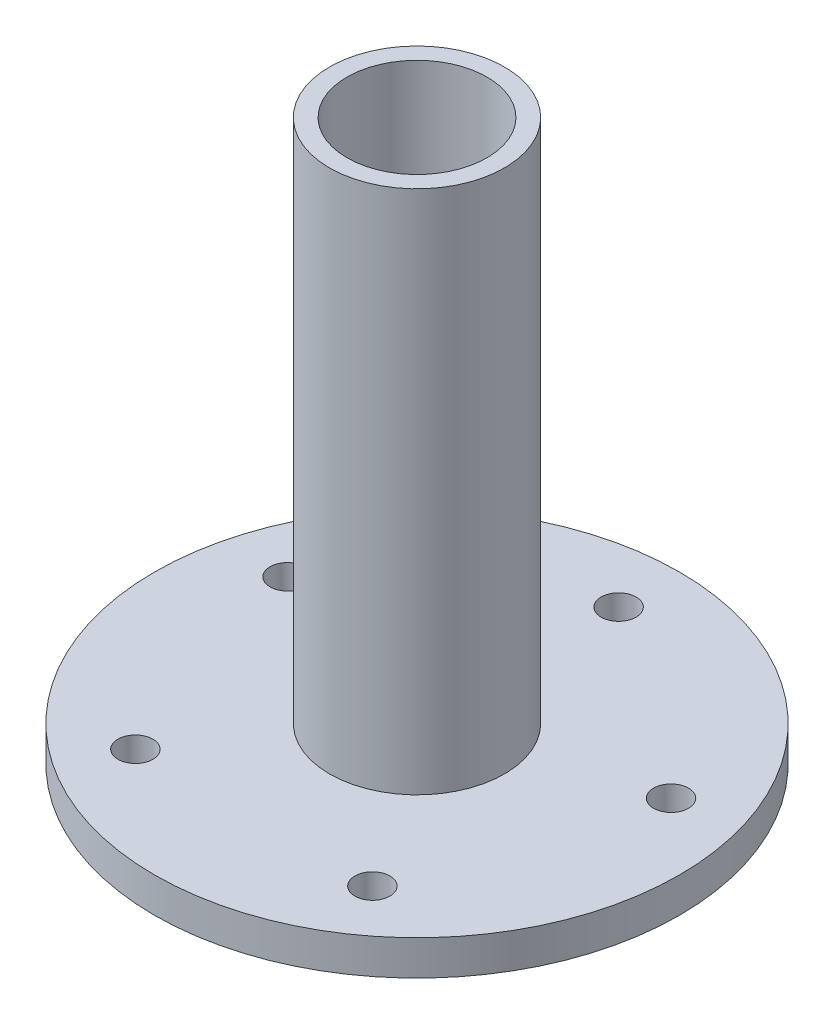
from build123d import *

# Parameters (mm, degrees)
SKETCH1_R           = 75
BOSS_EXTRUDE1_DEPTH = 10
SKETCH2_R           = 5
CUT_EXTRUDE1_DEPTH  = 10
SKETCH3_R           = 20
CUT_EXTRUDE2_DEPTH  = 10
BOSS_EXTRUDE2_START = 150
SKETCH4_R           = 25
SKETCH4_R_2         = 20
BOSS_EXTRUDE2_DEPTH = 150


with BuildPart() as part:
    # Sketch1 → Boss-Extrude1 (new body)
    with BuildSketch(Plane(origin=(0, 0, 0), x_dir=(1, 0, 0), z_dir=(0, 1, 0))):
        with Locations(Location((0, 0, 0), (0, 0, 270))):
            Circle(SKETCH1_R)
    extrude(amount=BOSS_EXTRUDE1_DEPTH)

    # Sketch2 → Cut-Extrude1 (cut)
    with BuildSketch(Plane(origin=(0, 10, 0), x_dir=(1, 0, 0), z_dir=(0, 1, 0))):
        with Locations(Location((0, 57.614814887, 0), (0, 0, 270))):
            Circle(SKETCH2_R)
        with Locations(Location((54.794945134, 17.803956928, 0), (0, 0, 270))):
            Circle(SKETCH2_R)
        with Locations(Location((33.865138504, -46.611364372, 0), (0, 0, 270))):
            Circle(SKETCH2_R)
        with Locations(Location((-33.865138504, -46.611364372, 0), (0, 0, 270))):
            Circle(SKETCH2_R)
        with Locations(Location((-54.794945134, 17.803956928, 0), (0, 0, 270))):
            Circle(SKETCH2_R)
    extrude(amount=-CUT_EXTRUDE1_DEPTH, mode=Mode.SUBTRACT)

    # Sketch3 → Cut-Extrude2 (cut)
    with BuildSketch(Plane(origin=(0, 10, 0), x_dir=(1, 0, 0), z_dir=(0, 1, 0))):
        with Locations(Location((0, 0, 0), (0, 0, 270))):
            Circle(SKETCH3_R)
    extrude(amount=-CUT_EXTRUDE2_DEPTH, mode=Mode.SUBTRACT)

    # Sketch4 → Boss-Extrude2 (add)
    with BuildSketch(Plane(origin=(0, 10, 0), x_dir=(1, 0, 0), z_dir=(0, 1, 0)).offset(BOSS_EXTRUDE2_START)):
        with Locations(Location((0, 0, 0), (0, 0, 270))):
            Circle(SKETCH4_R)
        with Locations(Location((0, 0, 0), (0, 0, 270))):
            Circle(SKETCH4_R_2, mode=Mode.SUBTRACT)
    extrude(amount=-BOSS_EXTRUDE2_DEPTH)


solid = part.part
